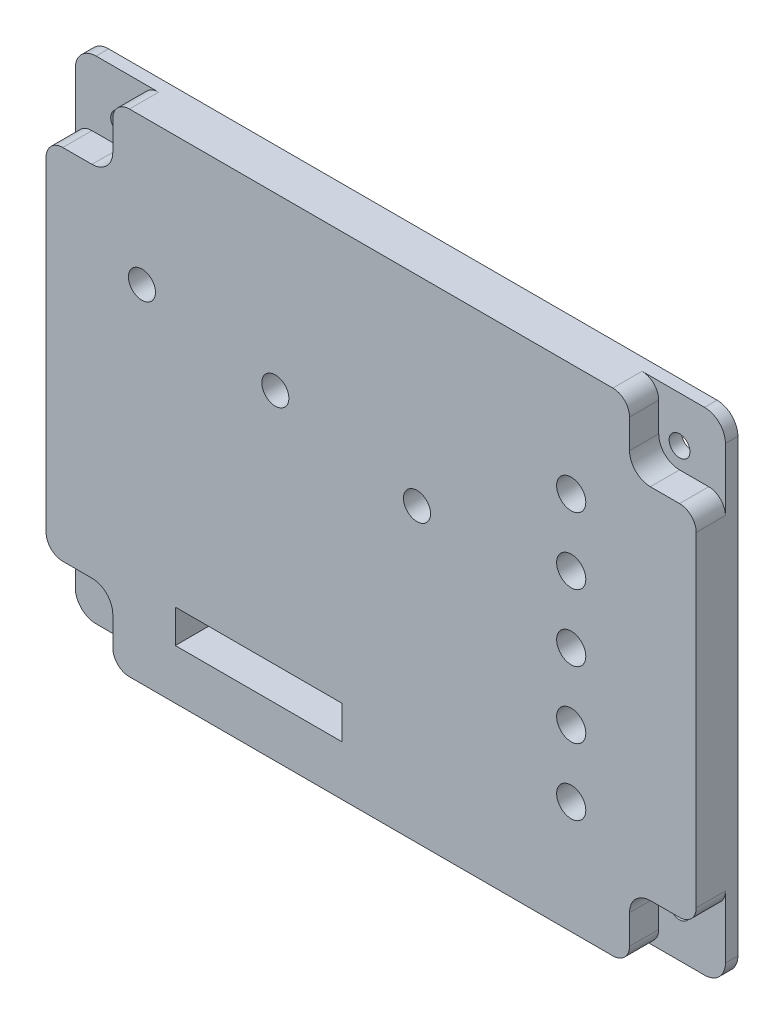
from build123d import *

# Parameters (mm, degrees)
SKETCH1_R           = 3.25
SKETCH1_R_2         = 3.5
SKETCH1_W           = 40
SKETCH1_H           = 8
BOSS_EXTRUDE1_DEPTH = 10
CUT_EXTRUDE1_DEPTH  = 7
SKETCH3_R           = 2.5
CUT_EXTRUDE2_DEPTH  = 10
FILLET1_R           = 4


with BuildPart() as part:
    # Sketch1 → Boss-Extrude1 (new body)
    with BuildSketch(Plane.XY):
        with BuildLine():
            Line((-67.614699332, 37.697104677), (78.385300668, 37.697104677))
            ThreePointArc((78.385300668, 37.697104677), (81.920834574, 36.232638583), (83.385300668, 32.697104677))
            Line((83.385300668, 32.697104677), (83.385300668, -75.302895323))
            ThreePointArc((83.385300668, -75.302895323), (81.920834574, -78.838429229), (78.385300668, -80.302895323))
            Line((78.385300668, -80.302895323), (-67.614699332, -80.302895323))
            ThreePointArc((-67.614699332, -80.302895323), (-71.150233238, -78.838429229), (-72.614699332, -75.302895323))
            Line((-72.614699332, -75.302895323), (-72.614699332, 32.697104677))
            ThreePointArc((-72.614699332, 32.697104677), (-71.150233238, 36.232638583), (-67.614699332, 37.697104677))
        make_face()
        with Locations((-49.614699332, 2.697104677)):
            Circle(SKETCH1_R, mode=Mode.SUBTRACT)
        with Locations((-17.614699332, -3.302895323)):
            Circle(SKETCH1_R, mode=Mode.SUBTRACT)
        with Locations((16.385300668, -10.302895323)):
            Circle(SKETCH1_R, mode=Mode.SUBTRACT)
        with Locations((53.385300668, 10.697104677)):
            Circle(SKETCH1_R_2, mode=Mode.SUBTRACT)
        with Locations((53.385300668, -5.302895323)):
            Circle(SKETCH1_R_2, mode=Mode.SUBTRACT)
        with Locations((53.385300668, -21.302895323)):
            Circle(SKETCH1_R_2, mode=Mode.SUBTRACT)
        with Locations((53.385300668, -37.302895323)):
            Circle(SKETCH1_R_2, mode=Mode.SUBTRACT)
        with Locations((53.385300668, -53.302895323)):
            Circle(SKETCH1_R_2, mode=Mode.SUBTRACT)
        with Locations((-21.614699332, -64.302895323)):
            Rectangle(SKETCH1_W, SKETCH1_H, mode=Mode.SUBTRACT)
    extrude(amount=BOSS_EXTRUDE1_DEPTH)

    # Sketch2 → Cut-Extrude1 (cut)
    with BuildSketch(Plane.XY.offset(10)):
        with BuildLine():
            Line((-72.614699332, 37.697104677), (-56.614699332, 37.697104677))
            Line((-56.614699332, 37.697104677), (-56.614699332, 26.697104677))
            ThreePointArc((-56.614699332, 26.697104677), (-58.079165426, 23.161570771), (-61.614699332, 21.697104677))
            Line((-61.614699332, 21.697104677), (-72.614699332, 21.697104677))
            Line((-72.614699332, 21.697104677), (-72.614699332, 37.697104677))
        make_face()
        with BuildLine():
            Line((83.385300668, 37.697104677), (67.385300668, 37.697104677))
            Line((67.385300668, 37.697104677), (67.385300668, 26.697104677))
            ThreePointArc((67.385300668, 26.697104677), (68.849766762, 23.161570771), (72.385300668, 21.697104677))
            Line((72.385300668, 21.697104677), (83.385300668, 21.697104677))
            Line((83.385300668, 21.697104677), (83.385300668, 37.697104677))
        make_face()
        with BuildLine():
            Line((83.385300668, -80.302895323), (67.385300668, -80.302895323))
            Line((67.385300668, -80.302895323), (67.385300668, -69.302895323))
            ThreePointArc((67.385300668, -69.302895323), (68.849766762, -65.767361417), (72.385300668, -64.302895323))
            Line((72.385300668, -64.302895323), (83.385300668, -64.302895323))
            Line((83.385300668, -64.302895323), (83.385300668, -80.302895323))
        make_face()
        with BuildLine():
            Line((-72.614699332, -80.302895323), (-56.614699332, -80.302895323))
            Line((-56.614699332, -80.302895323), (-56.614699332, -69.302895323))
            ThreePointArc((-56.614699332, -69.302895323), (-58.079165426, -65.767361417), (-61.614699332, -64.302895323))
            Line((-61.614699332, -64.302895323), (-72.614699332, -64.302895323))
            Line((-72.614699332, -64.302895323), (-72.614699332, -80.302895323))
        make_face()
    extrude(amount=-CUT_EXTRUDE1_DEPTH, mode=Mode.SUBTRACT)

    # Sketch3 → Cut-Extrude2 (cut)
    with BuildSketch(Plane.XY.offset(3)):
        with Locations((-61.614699332, 26.697104677)):
            Circle(SKETCH3_R)
        with Locations((72.385300668, 26.697104677)):
            Circle(SKETCH3_R)
        with Locations((72.385300668, -69.302895323)):
            Circle(SKETCH3_R)
        with Locations((-61.614699332, -69.302895323)):
            Circle(SKETCH3_R)
    extrude(amount=-CUT_EXTRUDE2_DEPTH, mode=Mode.SUBTRACT)

    # Fillet1
    fillet1_edges = [part.edges().sort_by_distance(p)[0] for p in [
        (83.385300668, -64.302895323, 6.5),
        (67.385300668, -80.302895323, 6.5),
        (67.385300668, 37.697104677, 6.5),
        (83.385300668, 21.697104677, 6.5),
        (-72.614699332, 21.697104677, 6.5),
        (-56.614699332, 37.697104677, 6.5),
        (-56.614699332, -80.302895323, 6.5),
        (-72.614699332, -64.302895323, 6.5),
    ]]
    fillet(fillet1_edges, radius=FILLET1_R)


solid = part.part
